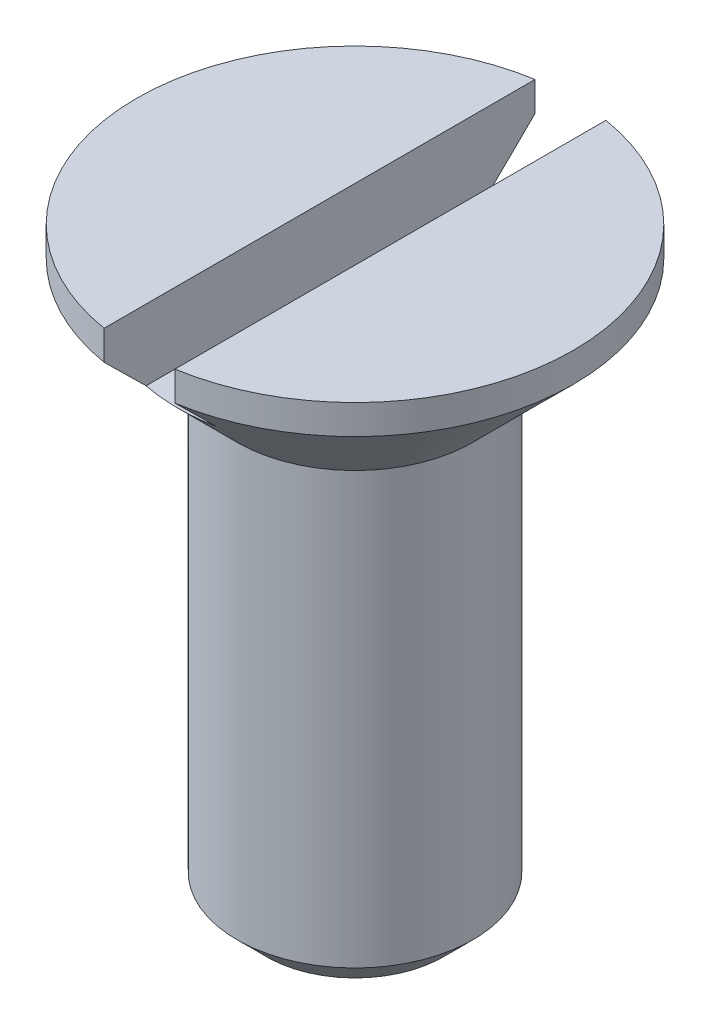
from build123d import *

# Parameters (mm, degrees)
CUT_EXTRUDE_1_DEPTH      = 12.28627485
CUT_EXTRUDE_1_DEPTH_BACK = 12.28627485
SKETCH_2_W               = 1.2
SKETCH_2_H               = 1.2


with BuildPart() as part:
    # Эскиз1 → Повернуть1 (revolve)
    with BuildSketch(Plane.XY):
        Polygon((0, 0), (-1.5, 0), (-2, 0.5), (-2, 7.8), (-3.7, 9.5), (-3.7, 10), (0, 10), align=None)
    revolve(axis=Axis((0, 10, 0), (0, -1, 0)))

    # Эскиз2 → Вырез-Вытянуть1 (cut, two sides: drawn at the far end of the back side and taken through both)
    with BuildSketch(Plane.XY.offset(-CUT_EXTRUDE_1_DEPTH_BACK)):
        with Locations((0, 9.4)):
            Rectangle(SKETCH_2_W, SKETCH_2_H)
    extrude(amount=CUT_EXTRUDE_1_DEPTH + CUT_EXTRUDE_1_DEPTH_BACK, mode=Mode.SUBTRACT)


solid = part.part
